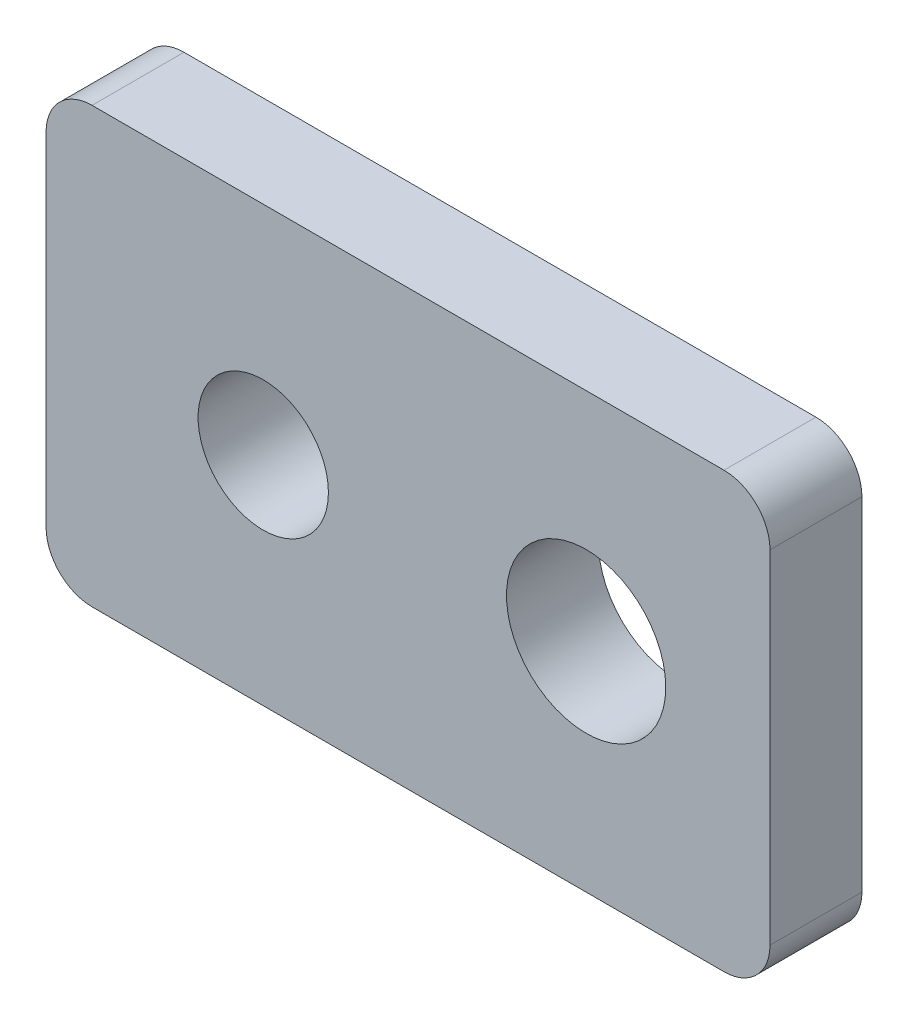
from build123d import *

# Parameters (mm, degrees)
SKETCH1_W            = 25
SKETCH1_H            = 15
SKETCH1_R            = 2.5
BOSS_EXTRUDE1_DEPTH  = 3.175
M5_CLEARANCE_HOLE1_D = 5.5
FILLET1_R            = 1.5875
M4_CLEARANCE_HOLE2_D = 4.5


with BuildPart() as part:
    # Sketch1 → Boss-Extrude1 (new body)
    # profile 1 of 2: a face of its own
    with BuildSketch(Plane.XY):
        Rectangle(SKETCH1_W, SKETCH1_H)
        with Locations((6.15, 0)):
            Circle(SKETCH1_R, mode=Mode.SUBTRACT)
    # profile 2 of 2: a face of its own
    with BuildSketch(Plane.XY):
        with Locations((6.15, 0)):
            Circle(SKETCH1_R)
    extrude(amount=BOSS_EXTRUDE1_DEPTH)

    # M5 Clearance Hole1 (through all)
    with Locations(Plane.XY.offset(3.175)):
        with Locations((6.15, 0)):
            Hole(M5_CLEARANCE_HOLE1_D / 2)

    # Fillet1
    fillet1_edges = [part.edges().sort_by_distance(p)[0] for p in [
        (12.5, -7.5, 1.5875),
        (-12.5, -7.5, 1.5875),
        (-12.5, 7.5, 1.5875),
        (12.5, 7.5, 1.5875),
    ]]
    fillet(fillet1_edges, radius=FILLET1_R)

    # M4 Clearance Hole2 (through all)
    with Locations(Plane.XY.offset(3.175)):
        with Locations((-5, 0)):
            Hole(M4_CLEARANCE_HOLE2_D / 2)


solid = part.part
